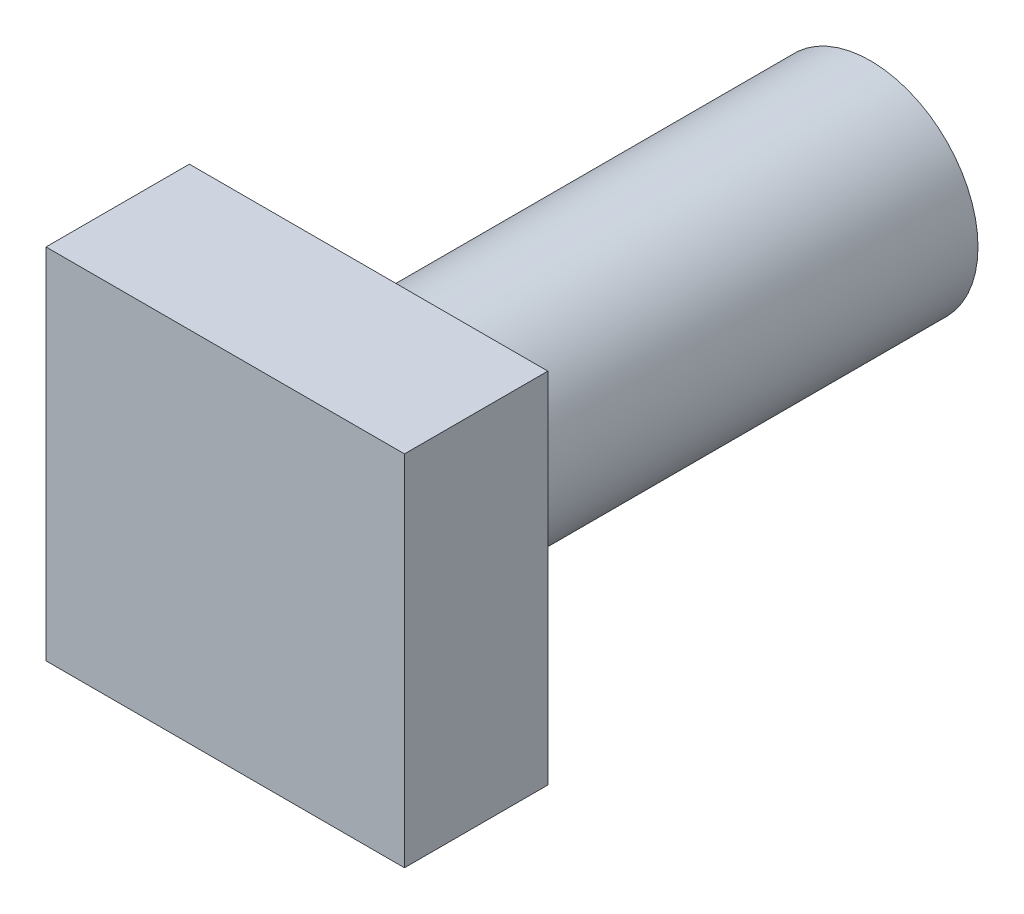
from build123d import *

# Parameters (mm, degrees)
SKETCH1_R           = 1.905
BOSS_EXTRUDE1_DEPTH = 8.89
SKETCH2_W           = 6.35
SKETCH2_H           = 6.35
BOSS_EXTRUDE2_DEPTH = 2.54


with BuildPart() as part:
    # Sketch1 → Boss-Extrude1 (new body)
    with BuildSketch(Plane.XY):
        Circle(SKETCH1_R)
    extrude(amount=-BOSS_EXTRUDE1_DEPTH)

    # Sketch2 → Boss-Extrude2 (add)
    with BuildSketch(Plane.XY):
        Rectangle(SKETCH2_W, SKETCH2_H)
    extrude(amount=BOSS_EXTRUDE2_DEPTH)


solid = part.part
